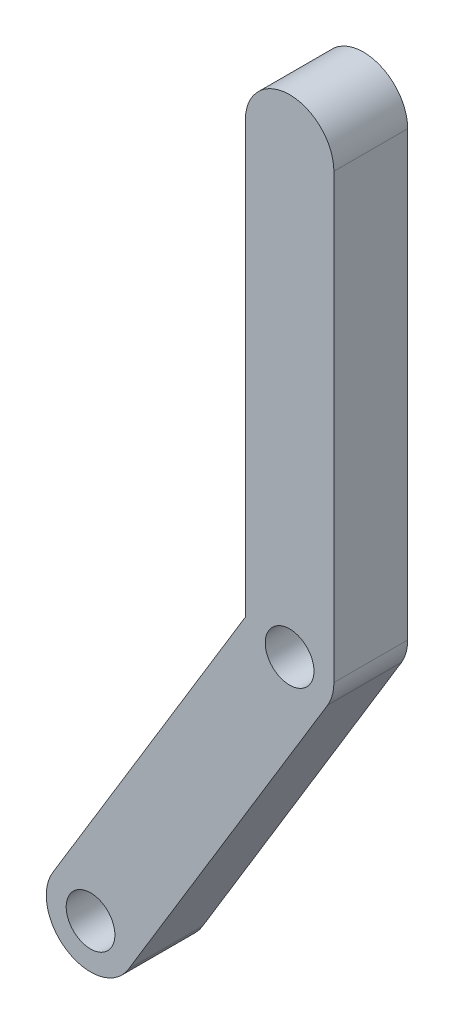
from build123d import *

# Parameters (mm, degrees)
SKIZZE1_R                       = 1.65
AUFSATZ_LINEAR_AUSTRAGEN1_DEPTH = 5


with BuildPart() as part:
    # Skizze1 → Aufsatz-Linear austragen1 (new body)
    with BuildSketch(Plane.XY):
        with BuildLine():
            Line((-3, 0.83853083), (-16.032249001, -20.637950845))
            ThreePointArc((-16.032249001, -20.637950845), (-15.044424487, -24.79244425), (-10.903217231, -23.750323726))
            Line((-10.903217231, -23.750323726), (2.584887481, -1.522615089))
            ThreePointArc((2.584887481, -1.522615089), (2.894361971, -0.789093643), (3, 0))
            Line((3, 0), (3, 30))
            ThreePointArc((3, 30), (0, 33), (-3, 30))
            Line((-3, 30), (-3, 0.83853083))
        make_face()
        Circle(SKIZZE1_R, mode=Mode.SUBTRACT)
        with Locations((-13.488104712, -22.227708637)):
            Circle(SKIZZE1_R, mode=Mode.SUBTRACT)
    extrude(amount=AUFSATZ_LINEAR_AUSTRAGEN1_DEPTH)


solid = part.part
